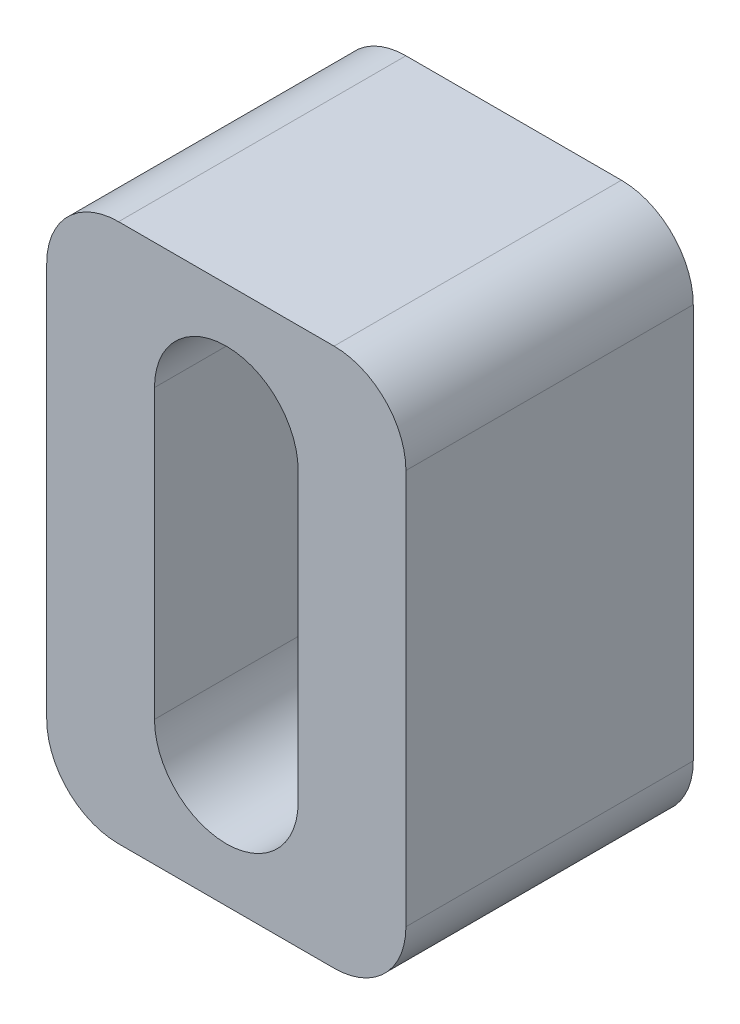
from build123d import *

# Parameters (mm, degrees)
SKETCH1_W           = 10
SKETCH1_H           = 15
BOSS_EXTRUDE1_DEPTH = 8
FILLET1_R           = 2


with BuildPart() as part:
    # Sketch1 → Boss-Extrude1 (new body)
    with BuildSketch(Plane.XY):
        with Locations((5, 7.5)):
            Rectangle(SKETCH1_W, SKETCH1_H)
        with BuildLine():
            Line((3, 3.5), (3, 11.5))
            ThreePointArc((3, 11.5), (5, 13.5), (7, 11.5))
            Line((7, 11.5), (7, 3.5))
            ThreePointArc((7, 3.5), (5, 1.5), (3, 3.5))
        make_face(mode=Mode.SUBTRACT)
    extrude(amount=BOSS_EXTRUDE1_DEPTH)

    # Fillet1
    fillet1_edges = [part.edges().sort_by_distance(p)[0] for p in [
        (0, 15, 4),
        (10, 15, 4),
        (10, 0, 4),
        (0, 0, 4),
    ]]
    fillet(fillet1_edges, radius=FILLET1_R)


solid = part.part
